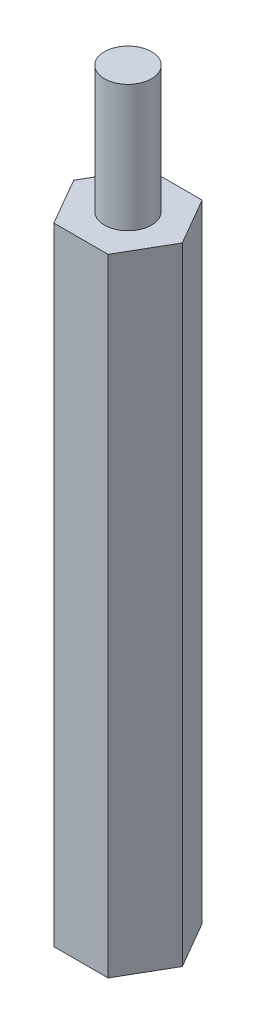
from build123d import *

# Parameters (mm, degrees)
BOSS_EXTRUDE1_DEPTH = 40
SKETCH5_R           = 1.5
BOSS_EXTRUDE2_DEPTH = 8.091605471
SKETCH6_R           = 1.5
CUT_EXTRUDE1_DEPTH  = 4


with BuildPart() as part:
    # Sketch3 → Boss-Extrude1 (new body)
    with BuildSketch(Plane(origin=(0, 0, 0), x_dir=(1, 0, 0), z_dir=(0, 1, 0))):
        Polygon((-3.464101615, 0), (-1.732050808, -3), (1.732050808, -3), (3.464101615, 0), (1.732050808, 3), (-1.732050808, 3), align=None)
    extrude(amount=BOSS_EXTRUDE1_DEPTH)

    # Sketch5 → Boss-Extrude2 (add)
    with BuildSketch(Plane(origin=(0, 40, 0), x_dir=(1, 0, 0), z_dir=(0, 1, 0))):
        with Locations(Location((0, 0, 0), (0, 0, 270))):
            Circle(SKETCH5_R)
    extrude(amount=BOSS_EXTRUDE2_DEPTH)

    # Sketch6 → Cut-Extrude1 (cut)
    with BuildSketch(Plane.XZ):
        with Locations(Location((0, 0, 0), (0, 0, 90))):
            Circle(SKETCH6_R)
    extrude(amount=-CUT_EXTRUDE1_DEPTH, mode=Mode.SUBTRACT)


solid = part.part
